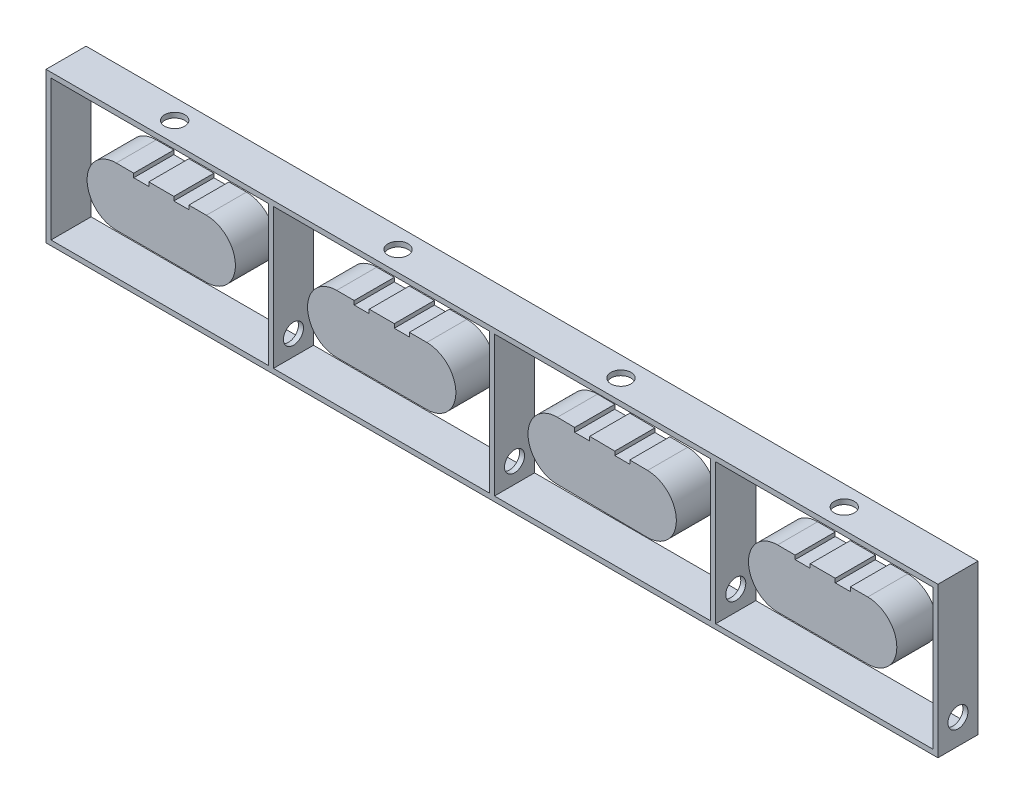
from build123d import *

# Parameters (mm, degrees)
SKETCH1_W               = 1780
SKETCH1_H               = 300
SKETCH1_W_2             = 1760
SKETCH1_H_2             = 280
BOSS_EXTRUDE1_DEPTH     = 40
BOSS_EXTRUDE1_2_DEPTH   = 40
BOSS_EXTRUDE1_3_DEPTH   = 40
BOSS_EXTRUDE1_4_DEPTH   = 40
BOSS_EXTRUDE1_5_DEPTH   = 40
CUT_EXTRUDE1_DEPTH      = 907.090503206
CUT_EXTRUDE1_DEPTH_BACK = 907.090503206
SKETCH2_W               = 30
SKETCH2_H               = 9.489507293
SKETCH2_H_2             = 11.073503662
EXTRUDE_THIN1_START     = -10
SKETCH3_W               = 10
SKETCH3_H               = 80
EXTRUDE_THIN1_DEPTH     = 280
SKETCH4_R               = 20
CUT_EXTRUDE2_DEPTH      = 47
SKETCH6_R               = 20
CUT_EXTRUDE4_DEPTH      = 1437


with BuildPart() as part:
    # Sketch1 → Boss-Extrude1 (new, symmetric)
    with BuildSketch(Plane.XY):
        Rectangle(SKETCH1_W, SKETCH1_H)
        Rectangle(SKETCH1_W_2, SKETCH1_H_2, mode=Mode.SUBTRACT)
    extrude(amount=BOSS_EXTRUDE1_DEPTH, both=True)

    # Sketch3 → Extrude-Thin1 (add)
    with BuildSketch(Plane(origin=(0, 150, 0), x_dir=(1, 0, 0), z_dir=(0, 1, 0)).offset(EXTRUDE_THIN1_START)):
        with Locations((-441.146590851, 0)):
            Rectangle(SKETCH3_W, SKETCH3_H)
        Rectangle(SKETCH3_W, SKETCH3_H)
        with Locations((441.565331283, 0)):
            Rectangle(SKETCH3_W, SKETCH3_H)
    extrude(amount=-EXTRUDE_THIN1_DEPTH)

    # Sketch4 → Cut-Extrude2 (cut)
    with BuildSketch(Plane(origin=(0, 150, 0), x_dir=(1, 0, 0), z_dir=(0, 1, 0))):
        with Locations(Location((663.102774446, 0, 0), (0, 0, 270))):
            Circle(SKETCH4_R)
        with Locations(Location((217.461848741, 0, 0), (0, 0, 270))):
            Circle(SKETCH4_R)
        with Locations(Location((-227.307563803, 0, 0), (0, 0, 270))):
            Circle(SKETCH4_R)
        with Locations(Location((-673.211735279, 0, 0), (0, 0, 270))):
            Circle(SKETCH4_R)
    extrude(amount=-CUT_EXTRUDE2_DEPTH, mode=Mode.SUBTRACT)

    # Sketch6 → Cut-Extrude4 (cut)
    with BuildSketch(Plane(origin=(890, 0, 0), x_dir=(0, 0, -1), z_dir=(1, 0, 0))):
        with Locations((0, -100)):
            Circle(SKETCH6_R)
    extrude(amount=-CUT_EXTRUDE4_DEPTH, mode=Mode.SUBTRACT)


with BuildPart() as body_2:
    # Sketch1 → Boss-Extrude1 2 (new, symmetric)
    with BuildSketch(Plane.XY):
        with BuildLine():
            Line((-750.100799598, -57.843362697), (-570.100799598, -58.156461816))
            ThreePointArc((-570.100799598, -58.156461816), (-512, -0.257436901), (-569.899024915, 57.843362697))
            Line((-569.899024915, 57.843362697), (-749.899024915, 58.156461816))
            ThreePointArc((-749.899024915, 58.156461816), (-807.999824513, 0.257436901), (-750.100799598, -57.843362697))
        make_face()
    extrude(amount=BOSS_EXTRUDE1_2_DEPTH, both=True)


with BuildPart() as body_3:
    # Sketch1 → Boss-Extrude1 3 (new, symmetric)
    with BuildSketch(Plane.XY):
        with BuildLine():
            Line((-310, -58), (-130, -58))
            ThreePointArc((-130, -58), (-72, 0), (-130, 58))
            Line((-130, 58), (-310, 58))
            ThreePointArc((-310, 58), (-368, 0), (-310, -58))
        make_face()
    extrude(amount=BOSS_EXTRUDE1_3_DEPTH, both=True)


with BuildPart() as body_4:
    # Sketch1 → Boss-Extrude1 4 (new, symmetric)
    with BuildSketch(Plane.XY):
        with BuildLine():
            Line((129.395432185, -57.053700429), (309.395432185, -58.939931076))
            ThreePointArc((309.395432185, -58.939931076), (368, -1.550867386), (310.61093631, 57.053700429))
            Line((310.61093631, 57.053700429), (130.61093631, 58.939931076))
            ThreePointArc((130.61093631, 58.939931076), (72.006368495, 1.550867386), (129.395432185, -57.053700429))
        make_face()
    extrude(amount=BOSS_EXTRUDE1_4_DEPTH, both=True)


with BuildPart() as body_5:
    # Sketch1 → Boss-Extrude1 5 (new, symmetric)
    with BuildSketch(Plane.XY):
        with BuildLine():
            Line((570, -58), (750, -58))
            ThreePointArc((750, -58), (808, 0), (750, 58))
            Line((750, 58), (570, 58))
            ThreePointArc((570, 58), (512, 0), (570, -58))
        make_face()
    extrude(amount=BOSS_EXTRUDE1_5_DEPTH, both=True)


with BuildPart() as cut_extrude1_tool:
    # Sketch2 → Cut-Extrude1 (new, two sides: drawn at the far end of the back side and taken through both)
    with BuildSketch(Plane.XY.offset(40).offset(-CUT_EXTRUDE1_DEPTH_BACK)):
        Polygon((-684.899024915, 58.043398245), (-714.899024915, 58.095581432), (-714.899024915, 50.095581432), (-684.899024915, 50.095581432), align=None)
        Polygon((-604.899024915, 57.904243081), (-634.899024915, 57.956426268), (-634.899024915, 49.956426268), (-604.899024915, 49.956426268), align=None)
        with Locations((-179.899024915, 54.701179915)):
            Rectangle(SKETCH2_W, SKETCH2_H)
        with Locations((-259.899024915, 55.632333263)):
            Rectangle(SKETCH2_W, SKETCH2_H_2)
        with Locations((180.100975085, 55.632333263)):
            Rectangle(SKETCH2_W, SKETCH2_H_2)
        with Locations((260.100975085, 54.701179915)):
            Rectangle(SKETCH2_W, SKETCH2_H)
        with Locations((700.100975085, 54.701179915)):
            Rectangle(SKETCH2_W, SKETCH2_H)
        with Locations((620.100975085, 55.632333263)):
            Rectangle(SKETCH2_W, SKETCH2_H_2)
    extrude(amount=CUT_EXTRUDE1_DEPTH + CUT_EXTRUDE1_DEPTH_BACK)


with BuildPart() as body_2_1:
    add(body_2.part)

    # Cut-Extrude1: cut by cut_extrude1_tool
    add(cut_extrude1_tool.part, mode=Mode.SUBTRACT)


with BuildPart() as body_3_1:
    add(body_3.part)

    # Cut-Extrude1: cut by cut_extrude1_tool
    add(cut_extrude1_tool.part, mode=Mode.SUBTRACT)


with BuildPart() as body_4_1:
    add(body_4.part)

    # Cut-Extrude1: cut by cut_extrude1_tool
    add(cut_extrude1_tool.part, mode=Mode.SUBTRACT)


with BuildPart() as body_5_1:
    add(body_5.part)

    # Cut-Extrude1: cut by cut_extrude1_tool
    add(cut_extrude1_tool.part, mode=Mode.SUBTRACT)


solid = Compound([part.part, body_2_1.part, body_3_1.part, body_4_1.part, body_5_1.part])
